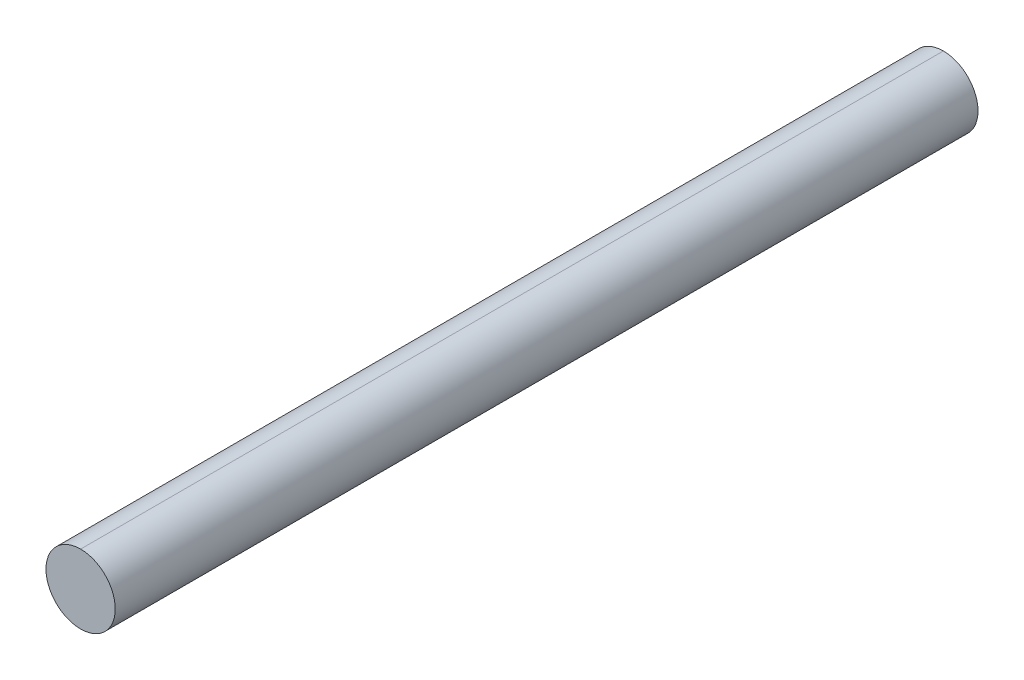
from build123d import *

# Parameters (mm, degrees)
SKETCH1_R           = 12.2
BOSS_EXTRUDE1_DEPTH = 304


with BuildPart() as part:
    # Sketch1 → Boss-Extrude1 (new body)
    with BuildSketch(Plane.XY):
        Circle(SKETCH1_R)
    extrude(amount=BOSS_EXTRUDE1_DEPTH)


solid = part.part
